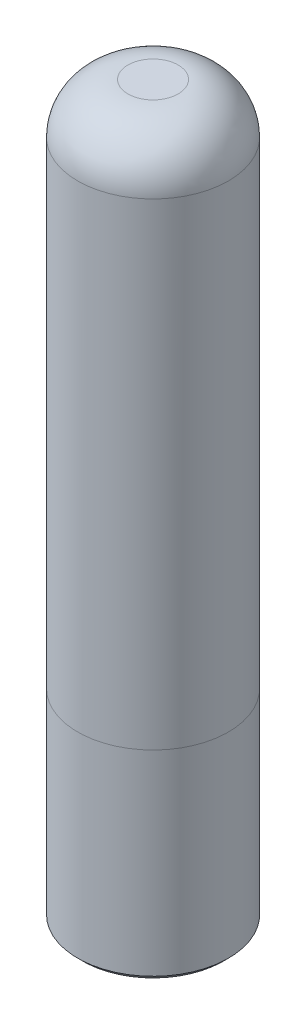
from build123d import *

# Parameters (mm, degrees)
SKETCH1_R           = 1.5
BOSS_EXTRUDE1_DEPTH = 10.5
FILLET1_R           = 1
SKETCH2_R           = 1.5
BOSS_EXTRUDE2_DEPTH = 4
CHAMFER1_SIZE       = 0.1


with BuildPart() as part:
    # Sketch1 → Boss-Extrude1 (new body)
    with BuildSketch(Plane(origin=(0, 0, 0), x_dir=(1, 0, 0), z_dir=(0, 1, 0))):
        with Locations(Location((0, 0, 0), (0, 0, 90))):
            Circle(SKETCH1_R)
    extrude(amount=BOSS_EXTRUDE1_DEPTH)

    # Fillet1
    fillet1_edges = [part.edges().sort_by_distance(p)[0] for p in [
        (0, 10.5, 1.5),
    ]]
    fillet(fillet1_edges, radius=FILLET1_R)


with BuildPart() as body_2:
    # Sketch2 → Boss-Extrude2 (new body)
    with BuildSketch(Plane.XZ):
        with Locations(Location((0, 0, 0), (0, 0, 270))):
            Circle(SKETCH2_R)
    extrude(amount=BOSS_EXTRUDE2_DEPTH)

    # Chamfer1
    chamfer1_edges = [body_2.edges().sort_by_distance(p)[0] for p in [
        (0, -4, 1.5),
    ]]
    chamfer(chamfer1_edges, length=CHAMFER1_SIZE)


solid = Compound([part.part, body_2.part])
